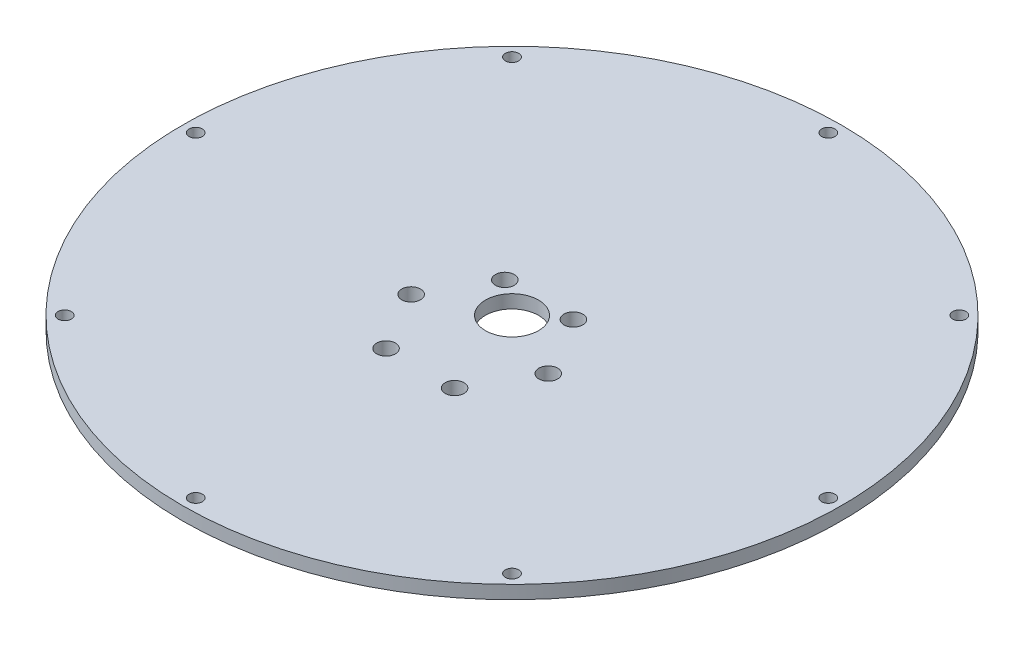
from build123d import *

# Parameters (mm, degrees)
SKETCH_2_R      = 74.5
SKETCH_2_R_2    = 1.5
SKETCH_2_R_3    = 2.125
SKETCH_2_R_4    = 6
EXTRUDE_1_DEPTH = 3


with BuildPart() as part:
    # 草图2 → 凸台-拉伸1 (new body)
    with BuildSketch(Plane(origin=(0, 0, 0), x_dir=(1, 0, 0), z_dir=(0, 1, 0))):
        with Locations(Location((0, 0, 0), (0, 0, 270))):
            Circle(SKETCH_2_R)
        with Locations(Location((-50.558134855, -50.558134855, 0), (0, 0, 270))):
            Circle(SKETCH_2_R_2, mode=Mode.SUBTRACT)
        with Locations(Location((-71.5, 0, 0), (0, 0, 270))):
            Circle(SKETCH_2_R_2, mode=Mode.SUBTRACT)
        with Locations(Location((0, -71.5, 0), (0, 0, 270))):
            Circle(SKETCH_2_R_2, mode=Mode.SUBTRACT)
        with Locations(Location((50.558134855, -50.558134855, 0), (0, 0, 270))):
            Circle(SKETCH_2_R_2, mode=Mode.SUBTRACT)
        with Locations(Location((-50.558134855, 50.558134855, 0), (0, 0, 270))):
            Circle(SKETCH_2_R_2, mode=Mode.SUBTRACT)
        with Locations(Location((71.5, 0, 0), (0, 0, 270))):
            Circle(SKETCH_2_R_2, mode=Mode.SUBTRACT)
        with Locations(Location((0, 71.5, 0), (0, 0, 270))):
            Circle(SKETCH_2_R_2, mode=Mode.SUBTRACT)
        with Locations(Location((50.558134855, 50.558134855, 0), (0, 0, 270))):
            Circle(SKETCH_2_R_2, mode=Mode.SUBTRACT)
        with Locations(Location((7.75, 6.123393759, 0), (0, 0, 270))):
            Circle(SKETCH_2_R_3, mode=Mode.SUBTRACT)
        with Locations(Location((-7.75, -20.723393759, 0), (0, 0, 270))):
            Circle(SKETCH_2_R_3, mode=Mode.SUBTRACT)
        with Locations(Location((-15.5, -7.3, 0), (0, 0, 270))):
            Circle(SKETCH_2_R_3, mode=Mode.SUBTRACT)
        with Locations(Location((7.75, -20.723393759, 0), (0, 0, 270))):
            Circle(SKETCH_2_R_3, mode=Mode.SUBTRACT)
        with Locations(Location((15.5, -7.3, 0), (0, 0, 270))):
            Circle(SKETCH_2_R_3, mode=Mode.SUBTRACT)
        with Locations(Location((-7.75, 6.123393759, 0), (0, 0, 270))):
            Circle(SKETCH_2_R_3, mode=Mode.SUBTRACT)
        with Locations(Location((0, 0, 0), (0, 0, 270))):
            Circle(SKETCH_2_R_4, mode=Mode.SUBTRACT)
    extrude(amount=EXTRUDE_1_DEPTH)


solid = part.part
